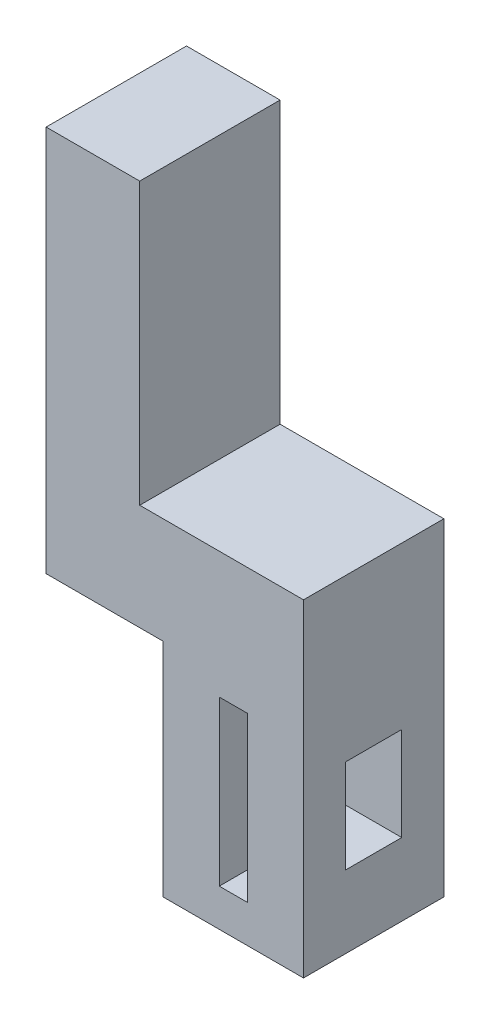
from build123d import *

# Parameters (mm, degrees)
SKETCH1_W           = 30
SKETCH1_H           = 30
BOSS_EXTRUDE1_DEPTH = 70
SKETCH2_W           = 6
SKETCH2_H           = 35
CUT_EXTRUDE1_DEPTH  = 82.853527719
SKETCH3_W           = 12
SKETCH3_H           = 20
CUT_EXTRUDE2_DEPTH  = 82.853527719
SKETCH4_W           = 30
SKETCH4_H           = 22.669600449
BOSS_EXTRUDE2_DEPTH = 25
SKETCH5_W           = 20
SKETCH5_H           = 30
BOSS_EXTRUDE3_DEPTH = 60


with BuildPart() as part:
    # Sketch1 → Boss-Extrude1 (new body)
    with BuildSketch(Plane(origin=(0, 0, 0), x_dir=(1, 0, 0), z_dir=(0, 1, 0))):
        with Locations((15, -15)):
            Rectangle(SKETCH1_W, SKETCH1_H)
    extrude(amount=BOSS_EXTRUDE1_DEPTH)

    # Sketch2 → Cut-Extrude1 (cut, through all)
    with BuildSketch(Plane.XY.offset(30)):
        with Locations((15, 25.5)):
            Rectangle(SKETCH2_W, SKETCH2_H)
    extrude(amount=-CUT_EXTRUDE1_DEPTH, mode=Mode.SUBTRACT)

    # Sketch3 → Cut-Extrude2 (cut, through all)
    with BuildSketch(Plane(origin=(30, 0, 0), x_dir=(0, 0, -1), z_dir=(1, 0, 0))):
        with Locations((-15, 25.5)):
            Rectangle(SKETCH3_W, SKETCH3_H)
    extrude(amount=-CUT_EXTRUDE2_DEPTH, mode=Mode.SUBTRACT)

    # Sketch4 → Boss-Extrude2 (add)
    with BuildSketch(Plane.ZY):
        with Locations((15, 58.665199775)):
            Rectangle(SKETCH4_W, SKETCH4_H)
    extrude(amount=BOSS_EXTRUDE2_DEPTH)

    # Sketch5 → Boss-Extrude3 (add)
    with BuildSketch(Plane(origin=(0, 70, 0), x_dir=(1, 0, 0), z_dir=(0, 1, 0))):
        with Locations((-15, -15)):
            Rectangle(SKETCH5_W, SKETCH5_H)
    extrude(amount=BOSS_EXTRUDE3_DEPTH)


solid = part.part
